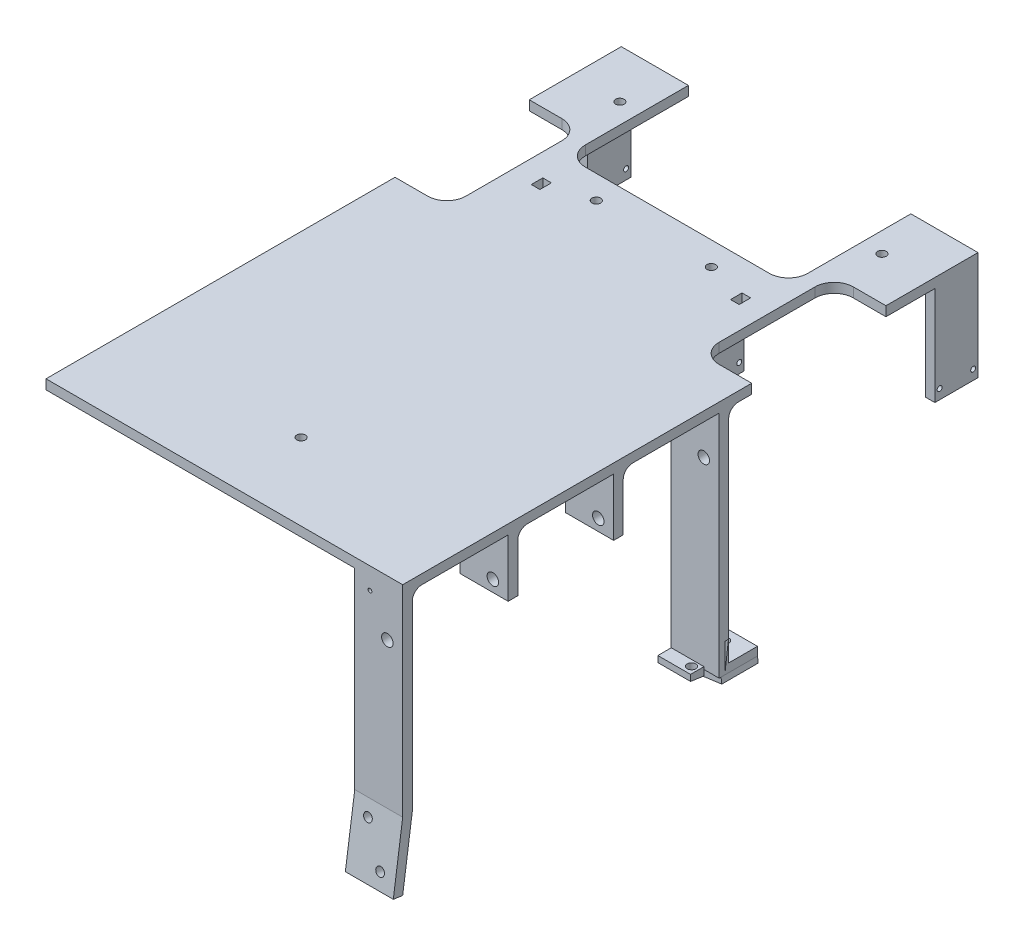
from build123d import *

# Parameters (mm, degrees)
BOSS_EXTRUDE1_DEPTH      = 5
SKETCH2_W                = 5
SKETCH2_H                = 22.5
BOSS_EXTRUDE2_DEPTH      = 38
SKETCH5_W                = 25
SKETCH5_H                = 5
BOSS_EXTRUDE3_DEPTH      = 30
FILLET3_R                = 5
SKETCH6_R                = 3
CUT_EXTRUDE4_DEPTH       = 172
SKETCH7_W                = 5
SKETCH7_H                = 22.5
BOSS_EXTRUDE4_DEPTH      = 51.5
SKETCH3_R                = 1.3
CUT_EXTRUDE2_DEPTH       = 357.71872673
SKETCH9_W                = 116
SKETCH9_H                = 63.779574991
CUT_EXTRUDE6_DEPTH       = 10
SKETCH10_W               = 25
SKETCH10_H               = 5
BOSS_EXTRUDE5_DEPTH      = 70
BOSS_EXTRUDE6_DEPTH      = 25
SKETCH12_W               = 25
SKETCH12_H               = 5
BOSS_EXTRUDE7_DEPTH      = 19.72
BOSS_EXTRUDE8_DEPTH      = 15
BOSS_EXTRUDE8_DEPTH_BACK = 4
CUT_EXTRUDE7_DEPTH       = 15
SKETCH15_R               = 2.25
CUT_EXTRUDE8_DEPTH       = 20
SKETCH16_W               = 6
SKETCH16_H               = 3
BOSS_EXTRUDE9_DEPTH      = 12.4
SKETCH17_R               = 1
CUT_EXTRUDE9_DEPTH       = 282.347152812
SKETCH27_W               = 25.232191294
SKETCH27_H               = 19
BOSS_EXTRUDE11_DEPTH     = 3
FILLET4_R                = 5
SKETCH18_R               = 2.25
CUT_EXTRUDE10_DEPTH      = 378.078044336
SKETCH19_W               = 4.5
SKETCH19_H               = 6
CUT_EXTRUDE12_DEPTH      = 383.13686347
FILLET6_R                = 10
SKETCH21_W               = 27
SKETCH21_H               = 70
CUT_EXTRUDE14_DEPTH      = 383.13686347
FILLET7_R                = 10
FILLET8_R                = 2.5
SKETCH22_R               = 2.25
CUT_EXTRUDE16_DEPTH      = 10
SKETCH23_W               = 17.043474802
SKETCH23_H               = 5.138762975
BOSS_EXTRUDE10_DEPTH     = 7
CUT_EXTRUDE17_REACH      = 372.436
CUT_EXTRUDE18_REACH      = 380.086
SKETCH25_R               = 2.25
SKETCH28_R               = 2.25
CUT_EXTRUDE19_DEPTH      = 384.936136276


with BuildPart() as part:
    # Sketch1 → Boss-Extrude1 (new body)
    with BuildSketch(Plane(origin=(0, 0, 0), x_dir=(1, 0, 0), z_dir=(0, 1, 0))):
        Polygon((0, 0), (0, -300), (186, -300), (186, 0), (176, 0), (151, 0), (151, -56.115865257), (35, -56.115865257), (35, 0), (10, 0), align=None)
    extrude(amount=BOSS_EXTRUDE1_DEPTH)

    # Sketch2 → Boss-Extrude2 (add)
    with BuildSketch(Plane.XZ):
        with Locations((53, 82.75)):
            Rectangle(SKETCH2_W, SKETCH2_H)
        with Locations((133, 82.75)):
            Rectangle(SKETCH2_W, SKETCH2_H)
    extrude(amount=BOSS_EXTRUDE2_DEPTH)

    # Sketch5 → Boss-Extrude3 (add)
    with BuildSketch(Plane.XZ):
        with Locations((173.5, 297.5)):
            Rectangle(SKETCH5_W, SKETCH5_H)
        with Locations((173.5, 242.5)):
            Rectangle(SKETCH5_W, SKETCH5_H)
        with Locations((173.5, 187.5)):
            Rectangle(SKETCH5_W, SKETCH5_H)
        with Locations((173.5, 132.5)):
            Rectangle(SKETCH5_W, SKETCH5_H)
    extrude(amount=BOSS_EXTRUDE3_DEPTH)

    # Fillet3
    fillet3_edges = [part.edges().sort_by_distance(p)[0] for p in [
        (173.5, 0, 295),
        (173.5, 0, 240),
        (173.5, 0, 185),
        (173.5, 0, 130),
    ]]
    fillet(fillet3_edges, radius=FILLET3_R)

    # Sketch6 → Cut-Extrude4 (cut)
    with BuildSketch(Plane.XY.offset(300)):
        with Locations((178, -24)):
            Circle(SKETCH6_R)
    extrude(amount=-CUT_EXTRUDE4_DEPTH, mode=Mode.SUBTRACT)

    # Sketch7 → Boss-Extrude4 (add)
    with BuildSketch(Plane.XZ):
        with Locations((2.5, 11.25)):
            Rectangle(SKETCH7_W, SKETCH7_H)
        with Locations((183.5, 11.25)):
            Rectangle(SKETCH7_W, SKETCH7_H)
    extrude(amount=BOSS_EXTRUDE4_DEPTH)

    # Sketch3 → Cut-Extrude2 (cut, through all)
    with BuildSketch(Plane(origin=(186, 0, 0), x_dir=(0, 0, -1), z_dir=(1, 0, 0))):
        with Locations((-74, -32.9)):
            Circle(SKETCH3_R)
        with Locations((-91.5, -32.9)):
            Circle(SKETCH3_R)
        with Locations((-20, -46.4)):
            Circle(SKETCH3_R)
        with Locations((-2.5, -46.4)):
            Circle(SKETCH3_R)
    extrude(amount=-CUT_EXTRUDE2_DEPTH, mode=Mode.SUBTRACT)

    # Sketch9 → Cut-Extrude6 (cut)
    with BuildSketch(Plane.XZ):
        with Locations((93, 31.889787496)):
            Rectangle(SKETCH9_W, SKETCH9_H)
    extrude(amount=-CUT_EXTRUDE6_DEPTH, mode=Mode.SUBTRACT)

    # Sketch10 → Boss-Extrude5 (add)
    with BuildSketch(Plane.XZ.offset(30)):
        with Locations((173.5, 297.5)):
            Rectangle(SKETCH10_W, SKETCH10_H)
        with Locations((173.5, 132.5)):
            Rectangle(SKETCH10_W, SKETCH10_H)
    extrude(amount=BOSS_EXTRUDE5_DEPTH)

    # Sketch11 → Boss-Extrude6 (add)
    with BuildSketch(Plane(origin=(186, 0, 0), x_dir=(0, 0, -1), z_dir=(1, 0, 0))):
        Polygon((-300, -100), (-304.901863346, -134.643852153), (-300, -135.337431613), (-295, -100), align=None)
    extrude(amount=-BOSS_EXTRUDE6_DEPTH)

    # Sketch12 → Boss-Extrude7 (add)
    with BuildSketch(Plane.XZ.offset(100)):
        with Locations((173.5, 132.5)):
            Rectangle(SKETCH12_W, SKETCH12_H)
    extrude(amount=BOSS_EXTRUDE7_DEPTH)

    # Sketch13 → Boss-Extrude8 (add, two sides: drawn at the far end of the back side and taken through both)
    with BuildSketch(Plane(origin=(0, 0, 130), x_dir=(-1, 0, 0), z_dir=(0, 0, -1)).offset(-BOSS_EXTRUDE8_DEPTH_BACK)):
        Polygon((-186, -115.314128401), (-186, -119.72), (-161, -123.135183378), (-161, -115.314128401), align=None)
    extrude(amount=BOSS_EXTRUDE8_DEPTH + BOSS_EXTRUDE8_DEPTH_BACK)

    # Sketch14 → Cut-Extrude7 (cut)
    with BuildSketch(Plane(origin=(19.462480736, -142.470246704, 0), x_dir=(0.9907978149243062, 0.13535024913615948, 0), z_dir=(0.13535024913615948, -0.9907978149243062, 0))):
        Polygon((186.357631366, 115), (168.084261749, 132.037436989), (198.015187573, 130.430954629), (197.515117956, 111.366582762), (186.357631366, 109.607523038), align=None)
    extrude(amount=-CUT_EXTRUDE7_DEPTH, mode=Mode.SUBTRACT)

    # Sketch15 → Cut-Extrude8 (cut)
    with BuildSketch(Plane(origin=(0, 39.65203451, 280.240211564), x_dir=(1, 0, 0), z_dir=(0, 0.14009757598944012, 0.9901377021414158))):
        with Locations(Location((178, -168.031966348, 0), (0, 0, 270))):
            Circle(SKETCH15_R)
        with Locations(Location((169, -149.043043011, 0), (0, 0, 270))):
            Circle(SKETCH15_R)
    extrude(amount=-CUT_EXTRUDE8_DEPTH, mode=Mode.SUBTRACT)

    # Sketch16 → Boss-Extrude9 (add)
    with BuildSketch(Plane.XZ):
        with Locations((169, 273.5)):
            Rectangle(SKETCH16_W, SKETCH16_H)
        with Locations((140.4, 273.5)):
            Rectangle(SKETCH16_W, SKETCH16_H)
        with Locations((169, 218.5)):
            Rectangle(SKETCH16_W, SKETCH16_H)
        with Locations((169, 163.5)):
            Rectangle(SKETCH16_W, SKETCH16_H)
        with Locations((140.4, 218.5)):
            Rectangle(SKETCH16_W, SKETCH16_H)
        with Locations((140.4, 163.5)):
            Rectangle(SKETCH16_W, SKETCH16_H)
    extrude(amount=BOSS_EXTRUDE9_DEPTH)

    # Sketch17 → Cut-Extrude9 (cut, through all)
    with BuildSketch(Plane(origin=(0, 0, 162), x_dir=(-1, 0, 0), z_dir=(0, 0, -1))):
        with BuildLine():
            ThreePointArc((-169.75, -5.6), (-169.95, -6.2), (-169.75, -6.8))
            ThreePointArc((-169.75, -6.8), (-168.633772234, -7.148683298), (-167.95, -6.2))
            ThreePointArc((-167.95, -6.2), (-168.633772234, -5.251316702), (-169.75, -5.6))
        make_face()
        with Locations((-140.45, -6.2)):
            Circle(SKETCH17_R)
    extrude(amount=-CUT_EXTRUDE9_DEPTH, mode=Mode.SUBTRACT)

    # Sketch27 → Boss-Extrude11 (add)
    with BuildSketch(Plane(origin=(19.462480736, -142.470246704, 0), x_dir=(0.9907978149243062, 0.13535024913615953, 0), z_dir=(0.13535024913615953, -0.9907978149243062, 0))):
        with Locations((155.468166102, 124.5)):
            Rectangle(SKETCH27_W, SKETCH27_H)
    extrude(amount=BOSS_EXTRUDE11_DEPTH)

    # Fillet4
    fillet4_edges = [part.edges().sort_by_distance(p)[0] for p in [
        (140.4, 0, 220),
        (169, 0, 165),
        (169, 0, 220),
        (140.4, 0, 275),
        (140.4, 0, 165),
        (169, 0, 275),
    ]]
    fillet(fillet4_edges, radius=FILLET4_R)

    # Sketch18 → Cut-Extrude10 (cut, through all)
    with BuildSketch(Plane(origin=(0, -115.314128401, 0), x_dir=(1, 0, 0), z_dir=(0, 1, 0))):
        with Locations(Location((174.885718372, -120.99470656, 0), (0, 0, 180))):
            Circle(SKETCH18_R)
    extrude(amount=-CUT_EXTRUDE10_DEPTH, mode=Mode.SUBTRACT)

    # Sketch19 → Cut-Extrude12 (cut, through all)
    with BuildSketch(Plane.XZ):
        with Locations((144.95, 82.75)):
            Rectangle(SKETCH19_W, SKETCH19_H)
        with Locations((41.05, 82.75)):
            Rectangle(SKETCH19_W, SKETCH19_H)
    extrude(amount=-CUT_EXTRUDE12_DEPTH, mode=Mode.SUBTRACT)

    # Fillet6
    fillet6_edges = [part.edges().sort_by_distance(p)[0] for p in [
        (35, 2.5, 63.779574991),
        (151, 2.5, 63.779574991),
    ]]
    fillet(fillet6_edges, radius=FILLET6_R)

    # Sketch21 → Cut-Extrude14 (cut, through all)
    with BuildSketch(Plane.XZ):
        with Locations((13.5, 83)):
            Rectangle(SKETCH21_W, SKETCH21_H)
        with Locations((172.5, 83)):
            Rectangle(SKETCH21_W, SKETCH21_H)
    extrude(amount=-CUT_EXTRUDE14_DEPTH, mode=Mode.SUBTRACT)

    # Fillet7
    fillet7_edges = [part.edges().sort_by_distance(p)[0] for p in [
        (27, 2.5, 118),
        (27, 2.5, 48),
        (159, 2.5, 48),
        (159, 2.5, 118),
    ]]
    fillet(fillet7_edges, radius=FILLET7_R)

    # Fillet8
    fillet8_edges = [part.edges().sort_by_distance(p)[0] for p in [
        (55.5, 0, 82.75),
        (130.5, 0, 82.75),
    ]]
    fillet(fillet8_edges, radius=FILLET8_R)

    # Sketch22 → Cut-Extrude16 (cut)
    with BuildSketch(Plane.XZ):
        with Locations(Location((123, 76.044790491, 0), (0, 0, 270))):
            Circle(SKETCH22_R)
        with Locations(Location((63, 76.044790491, 0), (0, 0, 270))):
            Circle(SKETCH22_R)
        with Locations(Location((24.5, 25.25, 0), (0, 0, 270))):
            Circle(SKETCH22_R)
        with Locations(Location((161.5, 25.617459027, 0), (0, 0, 270))):
            Circle(SKETCH22_R)
    extrude(amount=-CUT_EXTRUDE16_DEPTH, mode=Mode.SUBTRACT)

    # Sketch23 → Boss-Extrude10 (add)
    with BuildSketch(Plane.XY.offset(135)):
        with Locations((169.584553608, -121.006176699)):
            Rectangle(SKETCH23_W, SKETCH23_H)
    extrude(amount=BOSS_EXTRUDE10_DEPTH)

    # Sketch24 → Cut-Extrude17 (cut, up to next)
    with BuildSketch(Plane.ZY.offset(-161.062816207), mode=Mode.PRIVATE) as cut_extrude17_sk1:
        Polygon((142, -121.648432415), (135, -122.638883571), (134.714975443, -124.33810847), (142, -124.33810847), align=None)
    cut_extrude17_tool1 = extrude(cut_extrude17_sk1.sketch, amount=-CUT_EXTRUDE17_REACH, mode=Mode.PRIVATE) & part.part
    add(cut_extrude17_tool1.solids().sort_by_distance((161.062816, -123.230784, 138.703404))[0], mode=Mode.SUBTRACT)

    # Cut-Extrude18: up to this plane
    cut_extrude18_end = Plane(origin=(186.407050747, -121.648432415, 142), z_dir=(0, 0.9901377021414159, -0.14009757598943937))
    # Sketch25 → Cut-Extrude18 (cut, up to the surface)
    with BuildSketch(Plane(origin=(0, -118.436795211, 0), x_dir=(1, 0, 0), z_dir=(0, 1, 0)), mode=Mode.PRIVATE) as cut_extrude18_sk1:
        with Locations(Location((174.719138996, -138.089405518, 0), (0, 0, 270))):
            Circle(SKETCH25_R)
    cut_extrude18_tool1 = split(extrude(cut_extrude18_sk1.sketch, amount=-CUT_EXTRUDE18_REACH, mode=Mode.PRIVATE), bisect_by=cut_extrude18_end, keep=Keep.BOTH, mode=Mode.PRIVATE)
    add(cut_extrude18_tool1.solids().sort_by_distance((174.719139, -118.436795, 138.089406))[0], mode=Mode.SUBTRACT)

    # Sketch28 → Cut-Extrude19 (cut, through all)
    with BuildSketch(Plane(origin=(0, 5, 0), x_dir=(1, 0, 0), z_dir=(0, 1, 0))):
        with Locations(Location((93, -260, 0), (0, 0, 270))):
            Circle(SKETCH28_R)
    extrude(amount=-CUT_EXTRUDE19_DEPTH, mode=Mode.SUBTRACT)


solid = part.part
